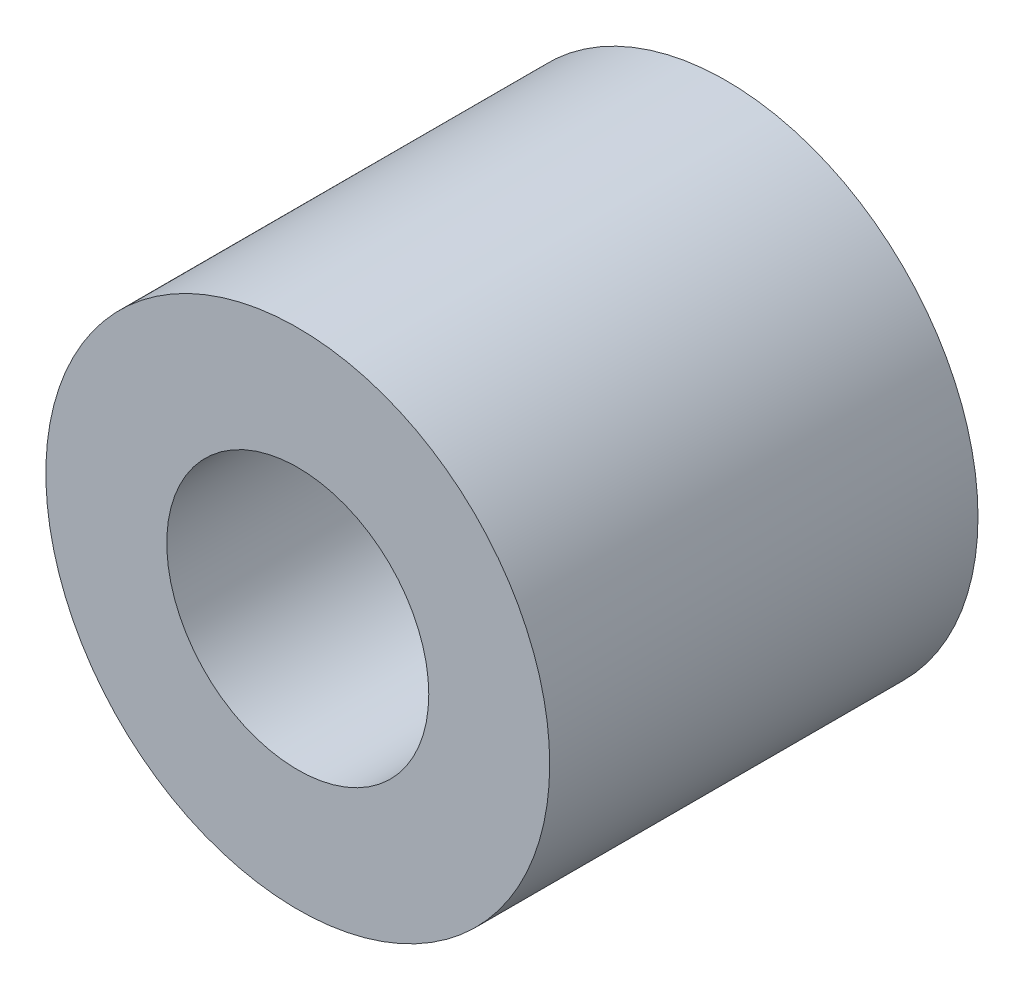
from build123d import *

# Parameters (mm, degrees)
SKETCH_1_R      = 5
SKETCH_1_R_2    = 2.6
EXTRUDE_1_DEPTH = 8.5


with BuildPart() as part:
    # 草图1 → 凸台-拉伸1 (new body)
    with BuildSketch(Plane.XY):
        Circle(SKETCH_1_R)
        Circle(SKETCH_1_R_2, mode=Mode.SUBTRACT)
    extrude(amount=EXTRUDE_1_DEPTH)


solid = part.part
